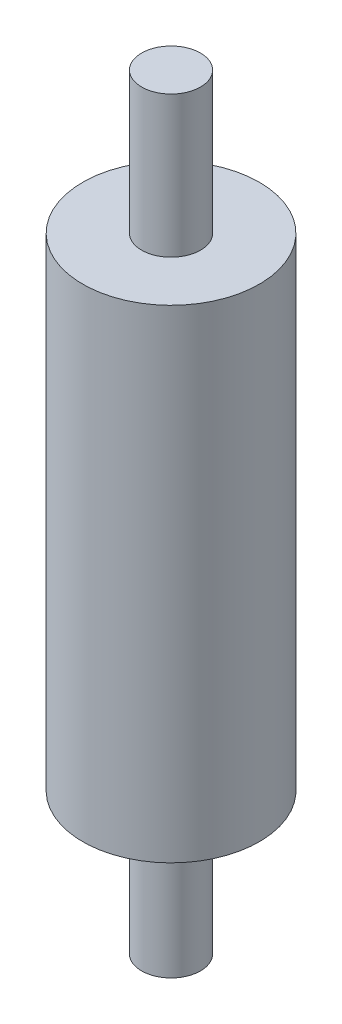
from build123d import *


with BuildPart() as part:
    # Sketch1 → Revolve1 (revolve)
    with BuildSketch(Plane(origin=(0, 0, 0), x_dir=(0, 0, -1), z_dir=(1, 0, 0))):
        Polygon((0, -32.5), (2.5, -32.5), (2.5, -20.5), (7.5, -20.5), (7.5, 20.5), (2.5, 20.5), (2.5, 32.5), (0, 32.5), align=None)
    revolve(axis=Axis((0, 0, 0), (0, 1, 0)))


solid = part.part
